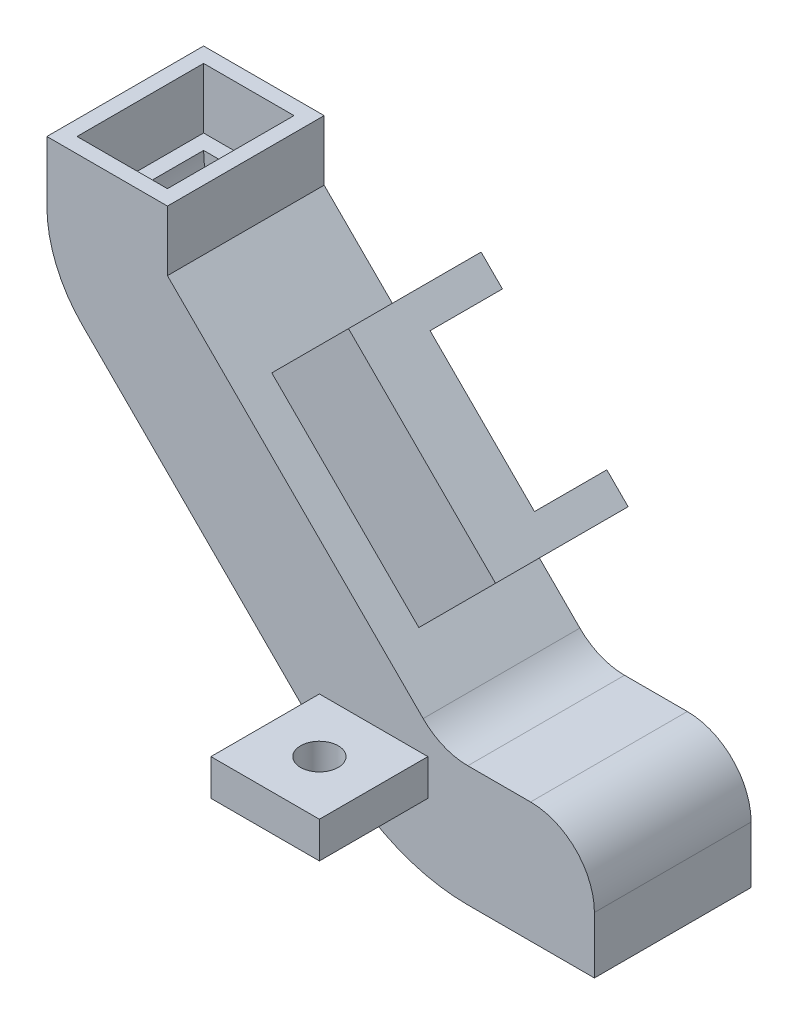
from build123d import *

# Parameters (mm, degrees)
BOSS_EXTRUDE1_DEPTH   = 16
BOSS_EXTRUDE1_2_DEPTH = 16
BOSS_EXTRUDE4_DEPTH   = 5
BOSS_EXTRUDE5_START   = 5
BOSS_EXTRUDE5_DEPTH   = 5
SKETCH7_W             = 20
SKETCH7_H             = 26
SKETCH7_W_2           = 15
SKETCH7_H_2           = 21
BOSS_EXTRUDE6_DEPTH   = 10
SKETCH9_W             = 10
SKETCH9_H             = 34.5
BOSS_EXTRUDE7_DEPTH   = 18
BOSS_EXTRUDE8_DEPTH   = 12
CUT_EXTRUDE3_DEPTH    = 10
SKETCH12_W            = 18
SKETCH12_H            = 6
BOSS_EXTRUDE9_DEPTH   = 18
SKETCH13_R            = 3.125
CUT_EXTRUDE4_DEPTH    = 18


with BuildPart() as part:
    # Sketch1 → Boss-Extrude1 (new body)
    with BuildSketch(Plane.XY):
        with BuildLine():
            Line((-40.982019254, 48.053087066), (1.444387617, 5.626680195))
            ThreePointArc((1.444387617, 5.626680195), (6.46743153, 2.270389555), (12.392515814, 1.091817013))
            Line((12.392515814, 1.091817013), (22.804554858, 1.091817013))
            ThreePointArc((22.804554858, 1.091817013), (26.755839943, -0.544858858), (28.392515814, -4.496143942))
            Line((28.392515814, -4.496143942), (28.392515814, -13.908182987))
            Line((28.392515814, -13.908182987), (33.392515814, -13.908182987))
            Line((33.392515814, -13.908182987), (33.392515814, -4.496143942))
            ThreePointArc((33.392515814, -4.496143942), (30.291373849, 2.990675048), (22.804554858, 6.091817013))
            Line((22.804554858, 6.091817013), (12.392515814, 6.091817013))
            ThreePointArc((12.392515814, 6.091817013), (8.380848692, 6.889787217), (4.979921523, 9.162214101))
            Line((4.979921523, 9.162214101), (-37.446485348, 51.588620972))
            Line((-37.446485348, 51.588620972), (-42.446485348, 51.588620972))
            ThreePointArc((-42.446485348, 51.588620972), (-42.065883011, 49.67520381), (-40.982019254, 48.053087066))
        make_face()
    extrude(amount=BOSS_EXTRUDE1_DEPTH)



with BuildPart() as body_2:
    # Sketch1 → Boss-Extrude1 2 (new body)
    with BuildSketch(Plane.XY):
        with BuildLine():
            Line((-48.053087066, 40.982019254), (-5.626680195, -1.444387617))
            ThreePointArc((-5.626680195, -1.444387617), (2.640597206, -6.96840577), (12.392515814, -8.908182987))
            Line((12.392515814, -8.908182987), (12.392515814, -13.908182987))
            ThreePointArc((12.392515814, -13.908182987), (0.727180044, -11.587803433), (-9.162214101, -4.979921523))
            Line((-9.162214101, -4.979921523), (-51.588620972, 37.446485348))
            ThreePointArc((-51.588620972, 37.446485348), (-55.924075998, 43.934952324), (-57.446485348, 51.588620972))
            Line((-57.446485348, 51.588620972), (-52.446485348, 51.588620972))
            ThreePointArc((-52.446485348, 51.588620972), (-51.304678336, 45.848369486), (-48.053087066, 40.982019254))
        make_face()
    extrude(amount=BOSS_EXTRUDE1_2_DEPTH)


with BuildPart() as part_1:
    add(part.part)

    add(body_2.part)  # Boss-Extrude4 merges body 2
    # Sketch5 → Boss-Extrude4 (add)
    with BuildSketch(Plane.XY.offset(16)):
        with BuildLine():
            Line((-57.446485348, 51.588620972), (-37.446485348, 51.588620972))
            Line((-37.446485348, 51.588620972), (4.979921523, 9.162214101))
            ThreePointArc((4.979921523, 9.162214101), (8.380848692, 6.889787217), (12.392515814, 6.091817013))
            Line((12.392515814, 6.091817013), (22.804554858, 6.091817013))
            ThreePointArc((22.804554858, 6.091817013), (30.291373849, 2.990675048), (33.392515814, -4.496143942))
            Line((33.392515814, -4.496143942), (33.392515814, -13.908182987))
            Line((33.392515814, -13.908182987), (12.392515814, -13.908182987))
            ThreePointArc((12.392515814, -13.908182987), (0.727180044, -11.587803433), (-9.162214101, -4.979921523))
            Line((-9.162214101, -4.979921523), (-51.588620972, 37.446485348))
            ThreePointArc((-51.588620972, 37.446485348), (-55.924075998, 43.934952324), (-57.446485348, 51.588620972))
        make_face()
    extrude(amount=BOSS_EXTRUDE4_DEPTH)

    # Sketch6 → Boss-Extrude5 (add)
    with BuildSketch(Plane(origin=(0, 0, 0), x_dir=(-1, 0, 0), z_dir=(0, 0, -1)).offset(BOSS_EXTRUDE5_START)):
        with BuildLine():
            Line((-4.979921523, 9.162214101), (37.446485348, 51.588620972))
            Line((37.446485348, 51.588620972), (57.446485348, 51.588620972))
            ThreePointArc((57.446485348, 51.588620972), (55.924075998, 43.934952324), (51.588620972, 37.446485348))
            Line((51.588620972, 37.446485348), (9.162214101, -4.979921523))
            ThreePointArc((9.162214101, -4.979921523), (-0.727180044, -11.587803433), (-12.392515814, -13.908182987))
            Line((-12.392515814, -13.908182987), (-33.392515814, -13.908182987))
            Line((-33.392515814, -13.908182987), (-33.392515814, -4.496143942))
            ThreePointArc((-33.392515814, -4.496143942), (-30.291373849, 2.990675048), (-22.804554858, 6.091817013))
            Line((-22.804554858, 6.091817013), (-12.392515814, 6.091817013))
            ThreePointArc((-12.392515814, 6.091817013), (-8.380848692, 6.889787217), (-4.979921523, 9.162214101))
        make_face()
        Polygon((28.607650583, 35.678718395), (10.929981054, 18.001048865), (18.001048865, 10.929981054), (35.678718395, 28.607650583), align=None, mode=Mode.SUBTRACT)
    extrude(amount=-BOSS_EXTRUDE5_DEPTH)

    # Sketch7 → Boss-Extrude6 (add)
    with BuildSketch(Plane(origin=(0, 51.588620972, 0), x_dir=(1, 0, 0), z_dir=(0, 1, 0))):
        with Locations((-47.446485348, -8)):
            Rectangle(SKETCH7_W, SKETCH7_H)
        with Locations((-47.446485348, -8)):
            Rectangle(SKETCH7_W_2, SKETCH7_H_2, mode=Mode.SUBTRACT)
    extrude(amount=BOSS_EXTRUDE6_DEPTH)

    # Sketch9 → Boss-Extrude7 (add)
    with BuildSketch(Plane(origin=(7.071067812, 7.071067812, 0), x_dir=(0, 0, -1), z_dir=(0.7071067811865486, 0.7071067811865465, 0))):
        with Locations((-10, 29.707327442)):
            Rectangle(SKETCH9_W, SKETCH9_H)
    extrude(amount=BOSS_EXTRUDE7_DEPTH)

    # Sketch10 → Boss-Extrude8 (add)
    with BuildSketch(Plane(origin=(0, 0, 5), x_dir=(-1, 0, 0), z_dir=(0, 0, -1))):
        Polygon((20.82947599, 45.578213332), (17.293942084, 42.042679426), (9.869320882, 49.467300628), (13.404854788, 53.002834534), align=None)
        Polygon((-10.990329163, 28.607650583), (-7.454795257, 32.143184489), (-0.030174055, 24.718563287), (-3.565707961, 21.183029381), align=None)
    extrude(amount=BOSS_EXTRUDE8_DEPTH)

    # Sketch11 → Cut-Extrude3 (cut)
    with BuildSketch(Plane(origin=(0, 0, -5), x_dir=(-1, 0, 0), z_dir=(0, 0, -1))):
        Polygon((24.365009896, 31.436077708), (20.82947599, 34.971611614), (16.233281912, 30.375417536), (9.515767491, 23.657903115), (13.051301397, 20.122369209), (19.768815818, 26.83988363), align=None)
    extrude(amount=-CUT_EXTRUDE3_DEPTH, mode=Mode.SUBTRACT)

    # Sketch12 → Boss-Extrude9 (add)
    with BuildSketch(Plane.XY.offset(21)):
        with Locations((-3.233952637, 1.091817013)):
            Rectangle(SKETCH12_W, SKETCH12_H)
    extrude(amount=BOSS_EXTRUDE9_DEPTH)

    # Sketch13 → Cut-Extrude4 (cut)
    with BuildSketch(Plane(origin=(0, 4.091817013, 0), x_dir=(1, 0, 0), z_dir=(0, 1, 0))):
        with Locations(Location((-3.233952637, -30, 0), (0, 0, 270))):
            Circle(SKETCH13_R)
    extrude(amount=-CUT_EXTRUDE4_DEPTH, mode=Mode.SUBTRACT)


solid = part_1.part
